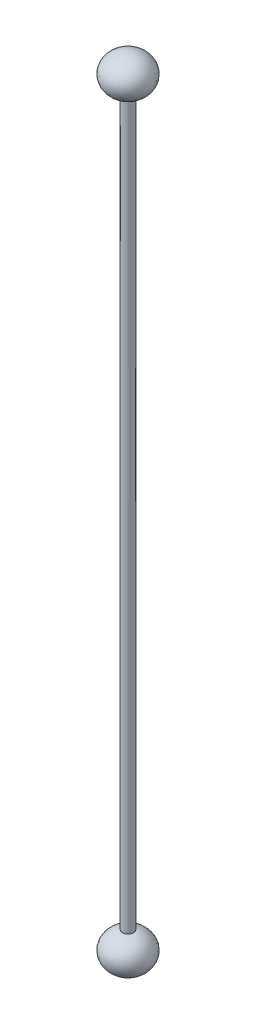
from build123d import *


with BuildPart() as part:
    # Sketch1 → Revolve2 (revolve)
    with BuildSketch(Plane.XY):
        with BuildLine():
            Line((0, 100.5), (0, 0))
            Line((0, 0), (0.75, 0))
            Line((0.75, 0), (0.75, 100.579385409))
            add(Edge.make_bspline(
                [(0, 100.5), (0.381049961, 100.5), (0.75, 100.579385409)],
                knots=[4.71238898, 4.71238898, 4.71238898, 4.98044602, 4.98044602, 4.98044602], degree=2, weights=[1, 0.950017652, 0.91709432]))
        make_face()
        with BuildLine():
            Line((0, 103), (0, 100.5))
            add(Edge.make_bspline(
                [(0, 100.5), (0.381049961, 100.5), (0.75, 100.579385409)],
                knots=[4.71238898, 4.71238898, 4.71238898, 4.98044602, 4.98044602, 4.98044602], degree=2, weights=[1, 0.950017652, 0.91709432]))
            Line((0.75, 100.579385409), (0.75, 103))
            Line((0.75, 103), (0, 103))
        make_face()
        with BuildLine():
            Line((0.75, 103), (0.75, 100.579385409))
            add(Edge.make_bspline(
                [(0.75, 100.579385409), (3, 101.063508327), (3, 103), (3, 105.5), (0, 105.5)],
                knots=[4.98044602, 4.98044602, 4.98044602, 6.283185307, 6.283185307, 7.853981634, 7.853981634, 7.853981634], degree=2, weights=[0.91709432, 0.757089129, 1, 0.707106781, 1]))
            Line((0, 105.5), (0, 103))
            Line((0, 103), (0.75, 103))
        make_face()
    revolve2 = revolve(axis=Axis((0, 0, 0), (0, 1, 0)))

    # Mirror1: Revolve2 across plane
    add(revolve2.mirror(Plane(origin=(0, 51.5, 0), x_dir=(0, 0, 1), z_dir=(0, -1, 0))))


solid = part.part
